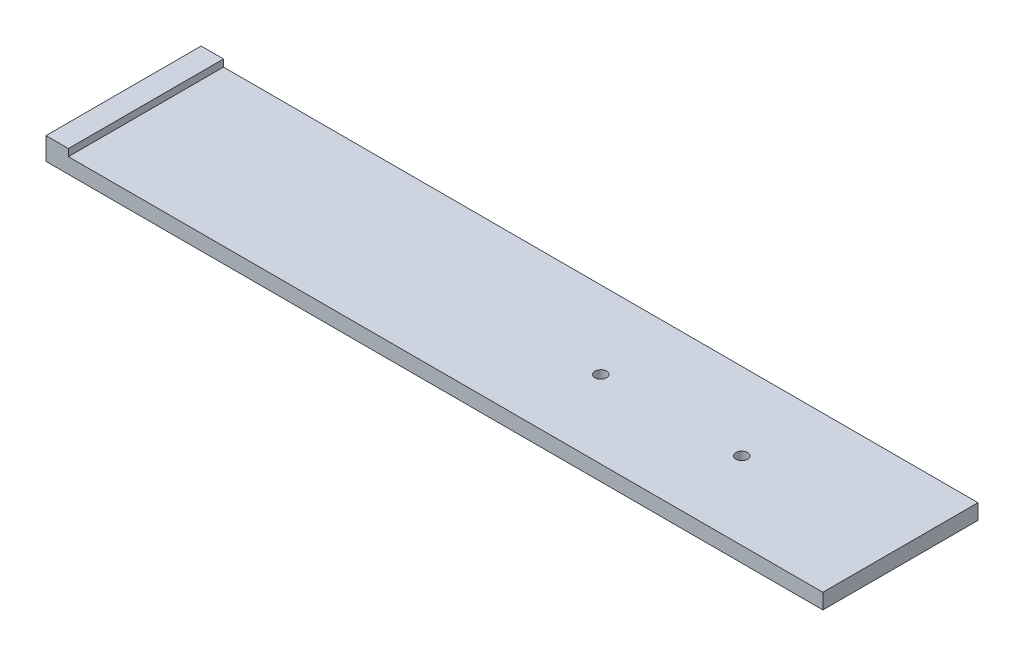
from build123d import *

# Parameters (mm, degrees)
SKETCH1_W             = 220.35
SKETCH1_H             = 44
BOSS_EXTRUDE1_DEPTH   = 4.35
SKETCH2_W             = 6.35
SKETCH2_H             = 44
BOSS_EXTRUDE2_DEPTH   = 2
M4X0_7_TAPPED_HOLE2_D = 3.3


with BuildPart() as part:
    # Sketch1 → Boss-Extrude1 (new body)
    with BuildSketch(Plane(origin=(0, 0, 0), x_dir=(1, 0, 0), z_dir=(0, 1, 0))):
        with Locations((110.175, 22)):
            Rectangle(SKETCH1_W, SKETCH1_H)
    extrude(amount=BOSS_EXTRUDE1_DEPTH)

    # Sketch2 → Boss-Extrude2 (add)
    with BuildSketch(Plane(origin=(0, 4.35, 0), x_dir=(1, 0, 0), z_dir=(0, 1, 0))):
        with Locations((3.175, 22)):
            Rectangle(SKETCH2_W, SKETCH2_H)
    extrude(amount=BOSS_EXTRUDE2_DEPTH)

    # M4x0.7 Tapped Hole2 (through all)
    with Locations(Plane(origin=(0, 4.35, 0), x_dir=(1, 0, 0), z_dir=(0, 1, 0))):
        with Locations((135.35, 22), (175.35, 22)):
            Hole(M4X0_7_TAPPED_HOLE2_D / 2)


solid = part.part
